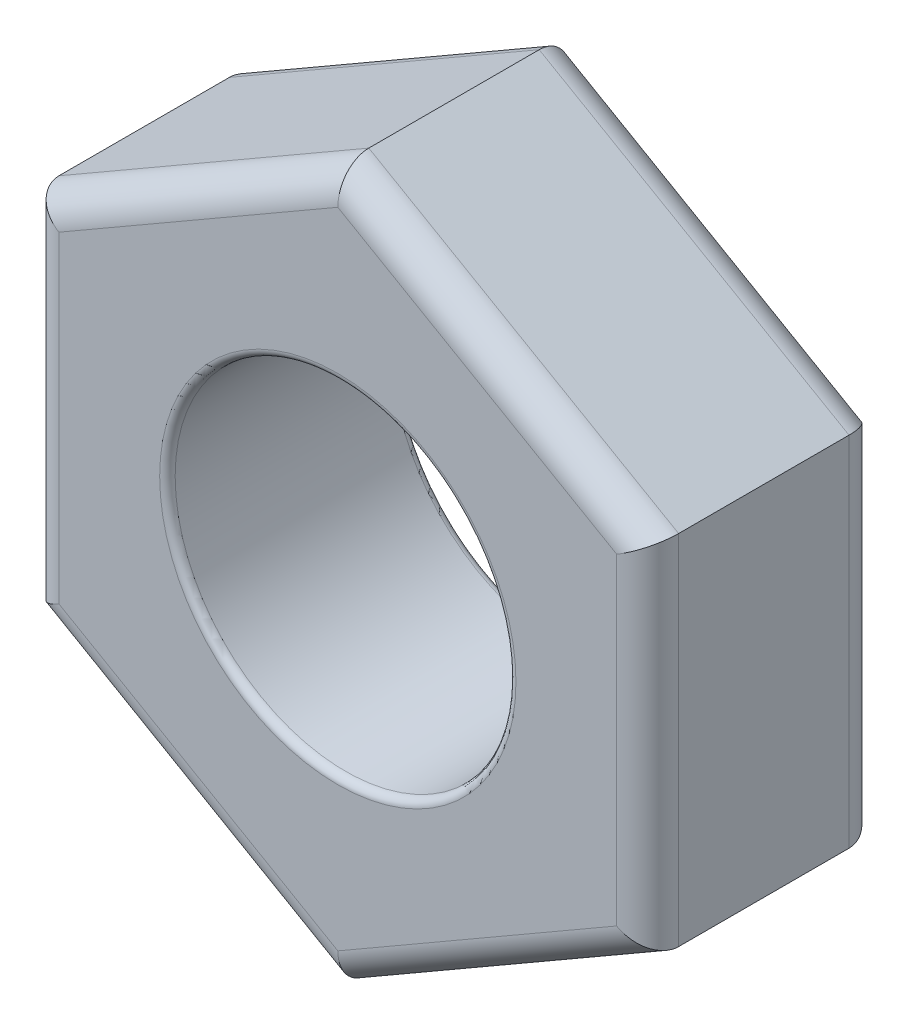
from build123d import *

# Parameters (mm, degrees)
SKETCH_1_R      = 11
EXTRUDE_1_DEPTH = 15
FILLET_1_R      = 2
FILLET_2_R      = 0.5


with BuildPart() as part:
    # 草图1 → 凸台-拉伸1 (new body)
    with BuildSketch(Plane.XY):
        Polygon((0, -23.094010768), (20, -11.547005384), (20, 11.547005384), (0, 23.094010768), (-20, 11.547005384), (-20, -11.547005384), align=None)
        Circle(SKETCH_1_R, mode=Mode.SUBTRACT)
    extrude(amount=EXTRUDE_1_DEPTH)

    # 圆角1
    fillet_1_edges = [part.edges().sort_by_distance(p)[0] for p in [
        (20, 0, 15),
        (10, 17.320508076, 15),
        (-10, 17.320508076, 15),
        (-20, 0, 15),
        (-10, -17.320508076, 15),
        (-20, 0, 0),
        (-10, 17.320508076, 0),
        (10, 17.320508076, 0),
        (10, -17.320508076, 15),
        (20, 0, 0),
        (10, -17.320508076, 0),
        (-10, -17.320508076, 0),
    ]]
    fillet(fillet_1_edges, radius=FILLET_1_R)

    # 圆角2
    fillet_2_edges = [part.edges().sort_by_distance(p)[0] for p in [
        (-11, 0, 0),
        (-11, 0, 15),
    ]]
    fillet(fillet_2_edges, radius=FILLET_2_R)


solid = part.part
